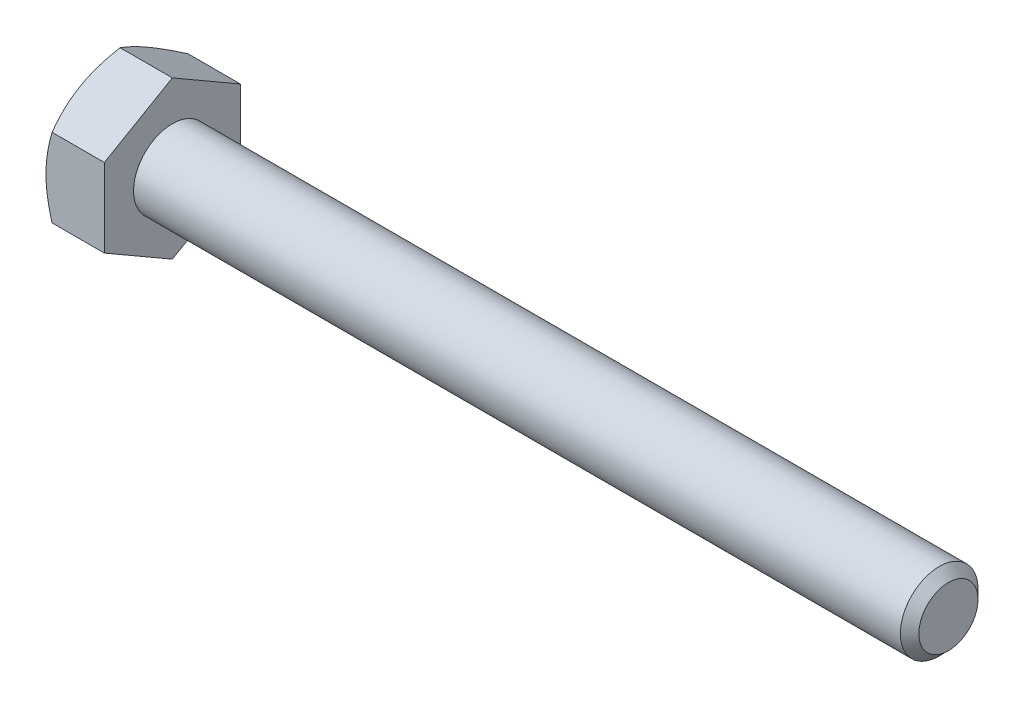
from build123d import *

# Parameters (mm, degrees)
BASEHEAD_DEPTH = 4.7752


with BuildPart() as part:
    # Sketch1 → BaseHead (new body)
    with BuildSketch(Plane(origin=(0, 0, 0), x_dir=(0, 0, -1), z_dir=(1, 0, 0))):
        Polygon((5.5626, 3.211568607), (5.5626, -3.211568607), (0, -6.423137215), (-5.5626, -3.211568607), (-5.5626, 3.211568607), (0, 6.423137215), align=None)
    extrude(amount=BASEHEAD_DEPTH)

    # BodySke → BaseBody (revolve)
    with BuildSketch(Plane.XY, mode=Mode.PRIVATE) as basebody_sk:
        Polygon((0, 0), (68.2752, 0), (68.2752, 2.41935), (67.51955, 3.175), (0, 3.175), align=None)
    revolve(basebody_sk.sketch.rotate(Axis((0, 0, 0), (1, 0, 0)), 90), axis=Axis((0, 0, 0), (1, 0, 0)))

    # Sketch3 → HeadChamfer (revolve, cut)
    with BuildSketch(Plane.XY):
        Polygon((0, 5.5626), (4.163005602, 12.773137215), (4.163005602, 19.123137215), (-12.7, 19.123137215), (-12.7, 5.5626), align=None)
    revolve(axis=Axis((0, 0, 0), (1, 0, 0)), mode=Mode.SUBTRACT)


solid = part.part
